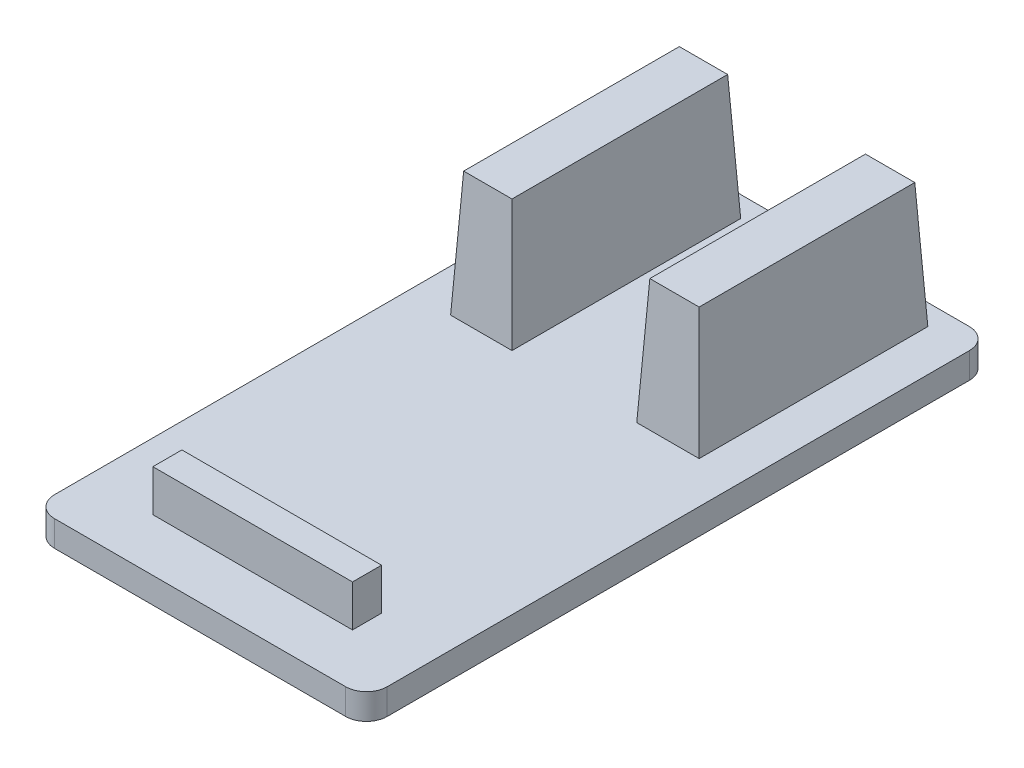
from build123d import *

# Parameters (mm, degrees)
SKETCH1_W           = 20.32
SKETCH1_H           = 38.1
BOSS_EXTRUDE1_DEPTH = 1.5748
FILLET2_R           = 1.27
SKETCH2_W           = 12.192
SKETCH2_H           = 1.772385225
BOSS_EXTRUDE2_DEPTH = 2.54
SKETCH5_W           = 3.750461367
SKETCH5_H           = 13.97
SKETCH5_W_2         = 3.81
BOSS_EXTRUDE3_DEPTH = 7.62
DRAFT2_ANGLE        = 3
DRAFT3_ANGLE        = 3


with BuildPart() as part:
    # Sketch1 → Boss-Extrude1 (new body)
    with BuildSketch(Plane(origin=(0, 0, 0), x_dir=(1, 0, 0), z_dir=(0, 1, 0))):
        with Locations((10.16, 19.05)):
            Rectangle(SKETCH1_W, SKETCH1_H)
    extrude(amount=BOSS_EXTRUDE1_DEPTH)

    # Fillet2
    fillet2_edges = [part.edges().sort_by_distance(p)[0] for p in [
        (20.32, 0.7874, -38.1),
        (0, 0.7874, -38.1),
        (0, 0.7874, 0),
        (20.32, 0.7874, 0),
    ]]
    fillet(fillet2_edges, radius=FILLET2_R)

    # Sketch2 → Boss-Extrude2 (add)
    with BuildSketch(Plane(origin=(0, 1.5748, 0), x_dir=(1, 0, 0), z_dir=(0, 1, 0))):
        with Locations((10.16, 4.097897191)):
            Rectangle(SKETCH2_W, SKETCH2_H)
    extrude(amount=BOSS_EXTRUDE2_DEPTH)

    # Sketch5 → Boss-Extrude3 (add)
    with BuildSketch(Plane(origin=(0, 1.5748, 0), x_dir=(1, 0, 0), z_dir=(0, 1, 0))):
        with Locations((4.474769317, 29.845)):
            Rectangle(SKETCH5_W, SKETCH5_H)
        with Locations((15.875, 29.845)):
            Rectangle(SKETCH5_W_2, SKETCH5_H)
    extrude(amount=BOSS_EXTRUDE3_DEPTH)

    # Draft2
    draft2_faces = [part.faces().sort_by_distance(p)[0] for p in [
        (2.599538633, 5.3848, -29.845),
        (4.474769317, 5.3848, -36.83),
        (6.35, 5.3848, -29.845),
        (4.474769317, 5.3848, -22.86),
    ]]
    draft(draft2_faces, Plane.ZX.offset(1.5748), DRAFT2_ANGLE)

    # Draft3
    draft3_faces = [part.faces().sort_by_distance(p)[0] for p in [
        (15.875, 5.3848, -22.86),
        (13.97, 5.3848, -29.845),
        (15.875, 5.3848, -36.83),
        (17.78, 5.3848, -29.845),
    ]]
    draft(draft3_faces, Plane.ZX.offset(1.5748), DRAFT3_ANGLE)


solid = part.part
